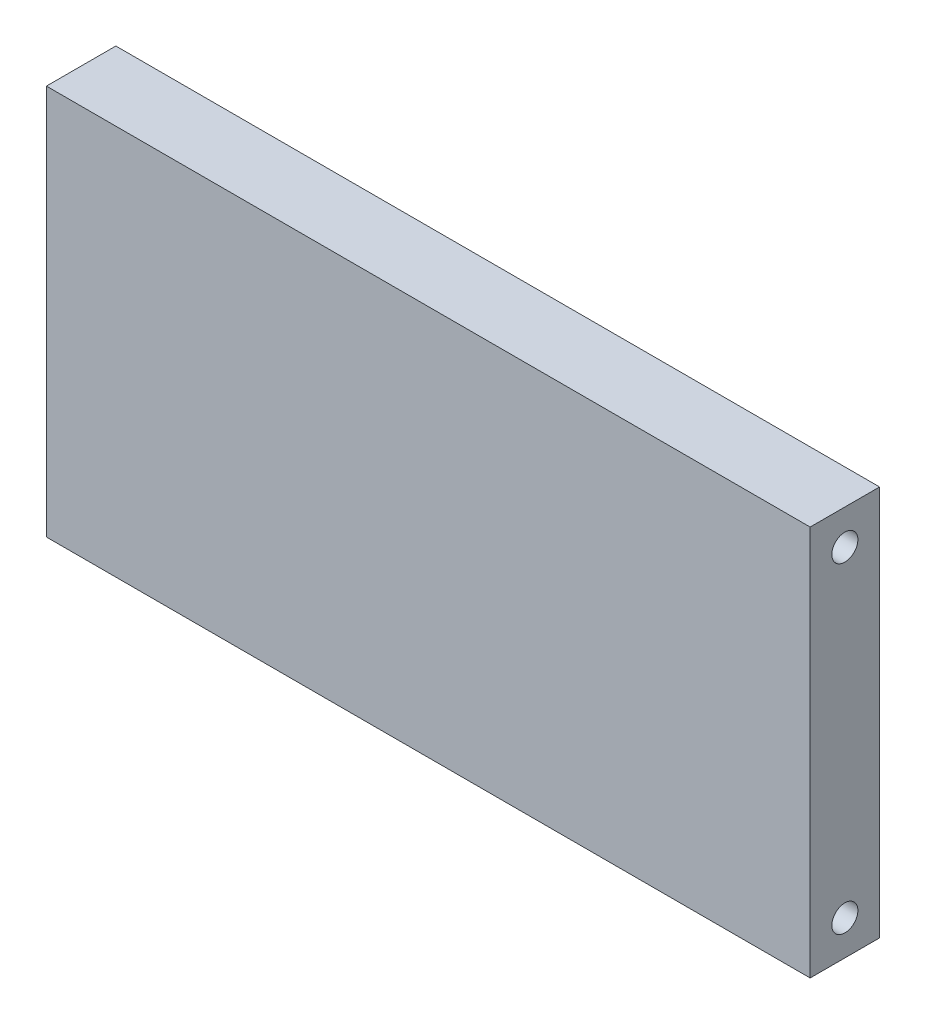
from build123d import *

# Parameters (mm, degrees)
SKETCH1_W           = 88
SKETCH1_H           = 45
BOSS_EXTRUDE1_DEPTH = 8
SKETCH2_R           = 1.5
CUT_EXTRUDE1_DEPTH  = 144


with BuildPart() as part:
    # Sketch1 → Boss-Extrude1 (new body)
    with BuildSketch(Plane.XY):
        with Locations((44, 22.5)):
            Rectangle(SKETCH1_W, SKETCH1_H)
    extrude(amount=BOSS_EXTRUDE1_DEPTH)

    # Sketch2 → Cut-Extrude1 (cut)
    with BuildSketch(Plane.ZY):
        with Locations((4, 41)):
            Circle(SKETCH2_R)
        with Locations((4, 4)):
            Circle(SKETCH2_R)
    extrude(amount=-CUT_EXTRUDE1_DEPTH, mode=Mode.SUBTRACT)


solid = part.part
